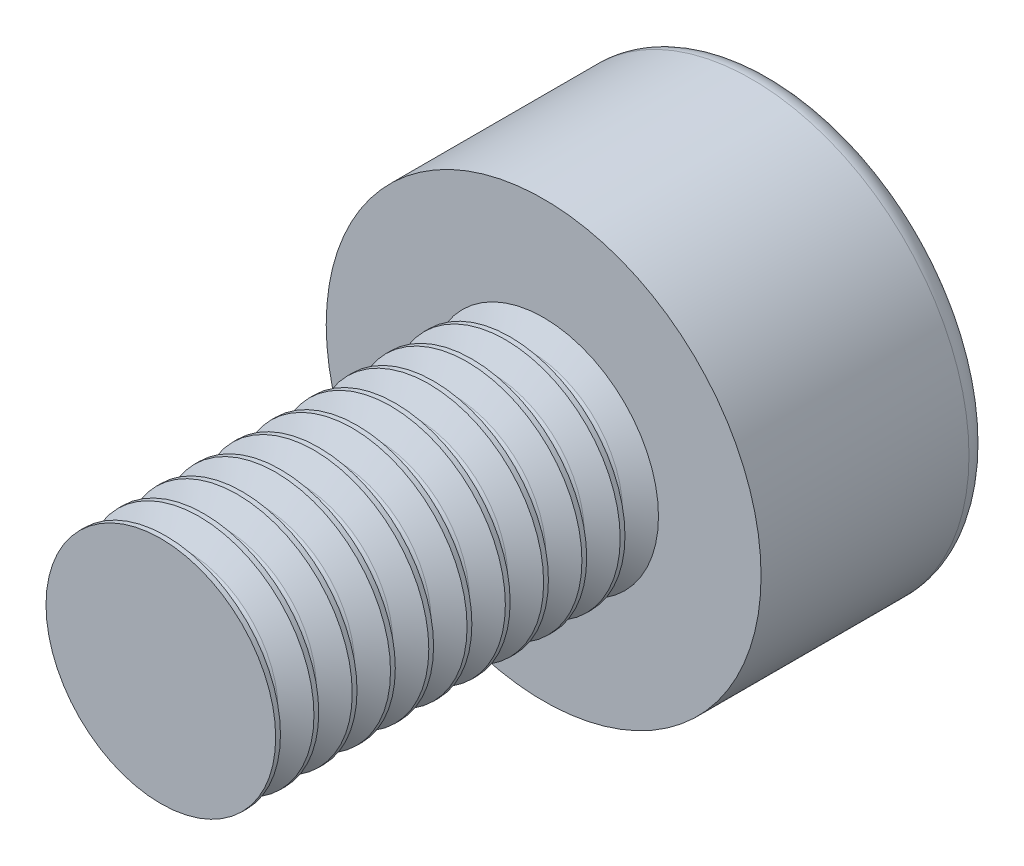
from build123d import *

# Parameters (mm, degrees)
CUT_EXTRUDE1_DEPTH = 1.5
FILLET1_R          = 0.284


with BuildPart() as part:
    # Sketch1 → Revolve1 (revolve)
    with BuildSketch(Plane.XZ):
        with BuildLine():
            Line((0, -3.000000001), (2.84, -3.000000001))
            Line((2.84, -3.000000001), (2.84, 0))
            Line((2.84, 0), (1.5, 0))
            Line((1.5, 0), (1.202303768, 0.171875))
            add(Edge.make_bspline(
                [(1.175240473, 0.21875), (1.175240473, 0.200707804), (1.186678768, 0.180896098), (1.202303768, 0.171875)],
                knots=[0, 0, 0, 0, 1, 1, 1, 1], degree=3))
            add(Edge.make_bspline(
                [(1.202303767, 0.265625), (1.186678767, 0.256603902), (1.175240473, 0.236792196), (1.175240473, 0.21875)],
                knots=[0, 0, 0, 0, 1, 1, 1, 1], degree=3))
            Line((1.202303767, 0.265625), (1.5, 0.4375))
            Line((1.5, 0.4375), (1.5, 0.5))
            Line((1.5, 0.5), (1.202303767, 0.671875))
            add(Edge.make_bspline(
                [(1.202303767, 0.671875), (1.186678767, 0.680896098), (1.175240473, 0.700707804), (1.175240473, 0.71875)],
                knots=[0, 0, 0, 0, 1, 1, 1, 1], degree=3))
            add(Edge.make_bspline(
                [(1.175240473, 0.71875), (1.175240473, 0.736792196), (1.186678767, 0.756603902), (1.202303767, 0.765625)],
                knots=[0, 0, 0, 0, 1, 1, 1, 1], degree=3))
            Line((1.202303767, 0.765625), (1.5, 0.9375))
            Line((1.5, 0.9375), (1.5, 1))
            Line((1.5, 1), (1.202303767, 1.171875))
            add(Edge.make_bspline(
                [(1.202303767, 1.171875), (1.186678767, 1.180896098), (1.175240473, 1.200707804), (1.175240473, 1.21875)],
                knots=[0, 0, 0, 0, 1, 1, 1, 1], degree=3))
            add(Edge.make_bspline(
                [(1.175240473, 1.21875), (1.175240473, 1.236792196), (1.186678767, 1.256603902), (1.202303767, 1.265625)],
                knots=[0, 0, 0, 0, 1, 1, 1, 1], degree=3))
            Line((1.202303767, 1.265625), (1.5, 1.4375))
            Line((1.5, 1.4375), (1.5, 1.5))
            Line((1.5, 1.5), (1.202303767, 1.671875))
            add(Edge.make_bspline(
                [(1.202303767, 1.671875), (1.186678767, 1.680896098), (1.175240473, 1.700707804), (1.175240473, 1.71875)],
                knots=[0, 0, 0, 0, 1, 1, 1, 1], degree=3))
            add(Edge.make_bspline(
                [(1.175240473, 1.71875), (1.175240473, 1.736792196), (1.186678767, 1.756603902), (1.202303767, 1.765625)],
                knots=[0, 0, 0, 0, 1, 1, 1, 1], degree=3))
            Line((1.202303767, 1.765625), (1.5, 1.9375))
            Line((1.5, 1.9375), (1.5, 2))
            Line((1.5, 2), (1.202303767, 2.171875))
            add(Edge.make_bspline(
                [(1.202303767, 2.171875), (1.186678767, 2.180896098), (1.175240473, 2.200707804), (1.175240473, 2.21875)],
                knots=[0, 0, 0, 0, 1, 1, 1, 1], degree=3))
            add(Edge.make_bspline(
                [(1.175240473, 2.21875), (1.175240473, 2.236792196), (1.186678767, 2.256603902), (1.202303767, 2.265625)],
                knots=[0, 0, 0, 0, 1, 1, 1, 1], degree=3))
            Line((1.202303767, 2.265625), (1.5, 2.4375))
            Line((1.5, 2.4375), (1.5, 2.5))
            Line((1.5, 2.5), (1.202303767, 2.671875))
            add(Edge.make_bspline(
                [(1.202303767, 2.671875), (1.186678767, 2.680896098), (1.175240473, 2.700707804), (1.175240473, 2.71875)],
                knots=[0, 0, 0, 0, 1, 1, 1, 1], degree=3))
            add(Edge.make_bspline(
                [(1.175240473, 2.71875), (1.175240473, 2.736792196), (1.186678767, 2.756603902), (1.202303767, 2.765625)],
                knots=[0, 0, 0, 0, 1, 1, 1, 1], degree=3))
            Line((1.202303767, 2.765625), (1.5, 2.9375))
            Line((1.5, 2.9375), (1.5, 3))
            Line((1.5, 3), (1.202303767, 3.171875))
            add(Edge.make_bspline(
                [(1.202303767, 3.171875), (1.186678767, 3.180896098), (1.175240473, 3.200707804), (1.175240473, 3.21875)],
                knots=[0, 0, 0, 0, 1, 1, 1, 1], degree=3))
            add(Edge.make_bspline(
                [(1.175240473, 3.21875), (1.175240473, 3.236792196), (1.186678767, 3.256603902), (1.202303767, 3.265625)],
                knots=[0, 0, 0, 0, 1, 1, 1, 1], degree=3))
            Line((1.202303767, 3.265625), (1.5, 3.4375))
            Line((1.5, 3.4375), (1.5, 3.5))
            Line((1.5, 3.5), (1.202303767, 3.671875))
            add(Edge.make_bspline(
                [(1.202303767, 3.671875), (1.186678767, 3.680896098), (1.175240473, 3.700707804), (1.175240473, 3.71875)],
                knots=[0, 0, 0, 0, 1, 1, 1, 1], degree=3))
            add(Edge.make_bspline(
                [(1.175240473, 3.71875), (1.175240473, 3.736792196), (1.186678767, 3.756603902), (1.202303767, 3.765625)],
                knots=[0, 0, 0, 0, 1, 1, 1, 1], degree=3))
            Line((1.202303767, 3.765625), (1.5, 3.9375))
            Line((1.5, 3.9375), (1.5, 4))
            Line((1.5, 4), (1.202303767, 4.171875))
            add(Edge.make_bspline(
                [(1.202303767, 4.171875), (1.186678767, 4.180896098), (1.175240473, 4.200707804), (1.175240473, 4.21875)],
                knots=[0, 0, 0, 0, 1, 1, 1, 1], degree=3))
            add(Edge.make_bspline(
                [(1.175240473, 4.21875), (1.175240473, 4.236792196), (1.186678767, 4.256603902), (1.202303767, 4.265625)],
                knots=[0, 0, 0, 0, 1, 1, 1, 1], degree=3))
            Line((1.202303767, 4.265625), (1.5, 4.4375))
            Line((1.5, 4.4375), (1.5, 4.5))
            Line((1.5, 4.5), (1.202303767, 4.671875))
            add(Edge.make_bspline(
                [(1.202303767, 4.671875), (1.186678767, 4.680896098), (1.175240473, 4.700707804), (1.175240473, 4.71875)],
                knots=[0, 0, 0, 0, 1, 1, 1, 1], degree=3))
            add(Edge.make_bspline(
                [(1.175240473, 4.71875), (1.175240473, 4.736792196), (1.186678767, 4.756603902), (1.202303767, 4.765625)],
                knots=[0, 0, 0, 0, 1, 1, 1, 1], degree=3))
            Line((1.202303767, 4.765625), (1.5, 4.9375))
            Line((1.5, 4.9375), (1.5, 4.999999999))
            Line((1.5, 4.999999999), (0, 4.999999999))
            Line((0, 4.999999999), (0, -3.000000001))
        make_face()
    revolve(axis=Axis((0, 0, -3.000000001), (0, 0, 1)))

    # Sketch2 → Cut-Extrude1 (cut)
    with BuildSketch(Plane(origin=(0, 0, -3.000000001), x_dir=(-1, 0, 0), z_dir=(0, 0, -1))):
        Polygon((-1.443375673, 0), (-0.721687837, -1.25), (0.721687836, -1.25), (1.443375672, 0), (0.721687836, 1.25), (-0.721687837, 1.25), align=None)
    extrude(amount=-CUT_EXTRUDE1_DEPTH, mode=Mode.SUBTRACT)

    # Fillet1
    fillet1_edges = [part.edges().sort_by_distance(p)[0] for p in [
        (-2.84, 0, -3.000000001),
    ]]
    fillet(fillet1_edges, radius=FILLET1_R)


solid = part.part
